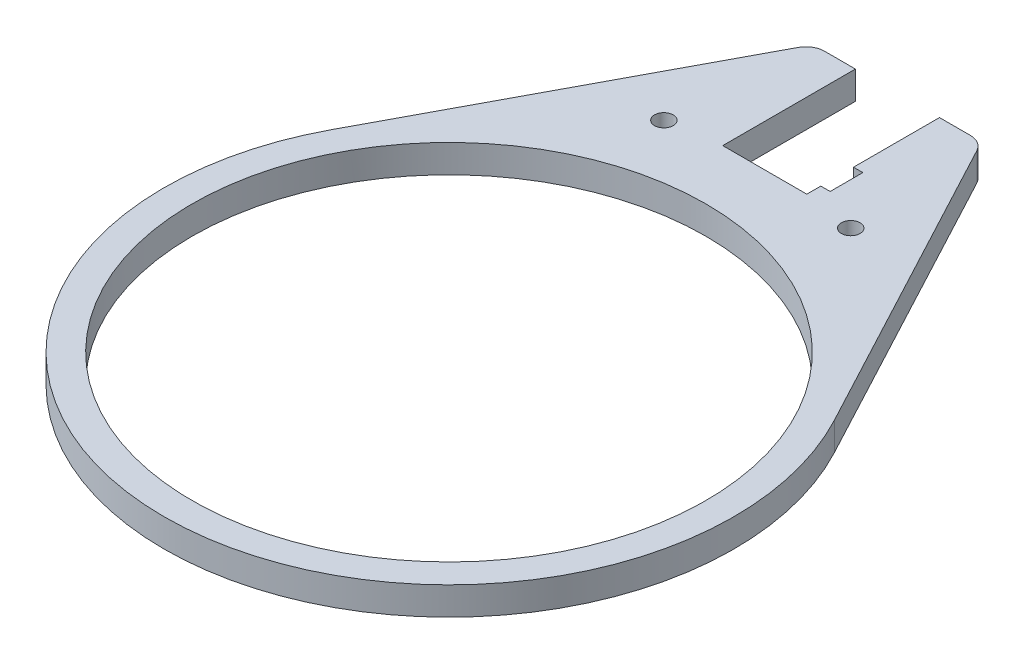
from build123d import *

# Parameters (mm, degrees)
BOSS_EXTRUDE1_DEPTH     = 1
BOSS_EXTRUDE2_DEPTH     = 2
SKETCH5_R               = 2.25
SKETCH5_R_2             = 0.5
CUT_EXTRUDE2_DEPTH      = 75.390311459
CUT_EXTRUDE3_DEPTH      = 75.423910398
CUT_EXTRUDE3_DEPTH_BACK = 75.423910398
SKETCH6_OUTSIDE_W       = 86.15
SKETCH6_OUTSIDE_H       = 123.471
SKETCH6_OUTSIDE_R       = 30.5
BOSS_EXTRUDE3_DEPTH     = 3
SKETCH8_W               = 9
SKETCH8_H               = 28.4
CUT_EXTRUDE4_DEPTH      = 3
SKETCH10_W              = 1.894041394
SKETCH10_H              = 3.5
CUT_EXTRUDE6_DEPTH      = 13
CUT_EXTRUDE7_DEPTH      = 57.949539067
CUT_EXTRUDE7_DEPTH_BACK = 57.949539067
SKETCH11_R              = 27.5
SKETCH11_W              = 9
SKETCH11_H              = 14.2
CUT_EXTRUDE8_DEPTH      = 57.949539067
CUT_EXTRUDE8_DEPTH_BACK = 57.949539067
SKETCH12_R              = 1


with BuildPart() as part:
    # Sketch2 → Boss-Extrude1 (new body)
    with BuildSketch(Plane(origin=(0, 0, 0), x_dir=(1, 0, 0), z_dir=(0, 1, 0))):
        with BuildLine():
            Line((-9.5, 67.820855486), (9.5, 67.820855486))
            ThreePointArc((9.5, 67.820855486), (11.621320344, 66.94217583), (12.5, 64.820855486))
            Line((12.5, 64.820855486), (12.5, 33.674916481))
            ThreePointArc((12.5, 33.674916481), (13.680828963, 28.960871273), (16.944444444, 25.360122288))
            ThreePointArc((16.944444444, 25.360122288), (0, -30.5), (-16.944444444, 25.360122288))
            ThreePointArc((-16.944444444, 25.360122288), (-13.680828963, 28.960871273), (-12.5, 33.674916481))
            Line((-12.5, 33.674916481), (-12.5, 64.820855486))
            ThreePointArc((-12.5, 64.820855486), (-11.621320344, 66.94217583), (-9.5, 67.820855486))
        make_face()
        with BuildLine():
            Line((3.5516796, -15.713533545), (4.759805249, -3.321913887))
            Line((4.759805249, -3.321913887), (6.334764225, -3.329153378))
            ThreePointArc((6.334764225, -3.329153378), (9.649898055, -0.044356931), (6.365101608, 3.270776898))
            Line((6.365101608, 3.270776898), (4.790142632, 3.278016389))
            Line((4.790142632, 3.278016389), (3.695984805, 15.680218773))
            ThreePointArc((3.695984805, 15.680218773), (0.087334891, 18.999799278), (-3.5516796, 15.713533545))
            Line((-3.5516796, 15.713533545), (-4.759805249, 3.321913887))
            Line((-4.759805249, 3.321913887), (-6.334764225, 3.329153378))
            ThreePointArc((-6.334764225, 3.329153378), (-9.649898055, 0.044356931), (-6.365101608, -3.270776898))
            Line((-6.365101608, -3.270776898), (-4.790142632, -3.278016389))
            Line((-4.790142632, -3.278016389), (-3.695984805, -15.680218773))
            ThreePointArc((-3.695984805, -15.680218773), (-0.087334891, -18.999799278), (3.5516796, -15.713533545))
        make_face(mode=Mode.SUBTRACT)
    extrude(amount=BOSS_EXTRUDE1_DEPTH)

    # Sketch3 → Boss-Extrude2 (add)
    with BuildSketch(Plane(origin=(0, 1, 0), x_dir=(1, 0, 0), z_dir=(0, 1, 0))):
        with BuildLine():
            Line((-12.5, 64.820855486), (-12.5, 33.674916481))
            ThreePointArc((-12.5, 33.674916481), (-13.680828963, 28.960871273), (-16.944444444, 25.360122288))
            ThreePointArc((-16.944444444, 25.360122288), (0, -30.5), (16.944444444, 25.360122288))
            ThreePointArc((16.944444444, 25.360122288), (13.680828963, 28.960871273), (12.5, 33.674916481))
            Line((12.5, 33.674916481), (12.5, 64.820855486))
            ThreePointArc((12.5, 64.820855486), (11.621320344, 66.94217583), (9.5, 67.820855486))
            Line((9.5, 67.820855486), (-9.5, 67.820855486))
            ThreePointArc((-9.5, 67.820855486), (-11.621320344, 66.94217583), (-12.5, 64.820855486))
        make_face()
    extrude(amount=BOSS_EXTRUDE2_DEPTH)

    # Sketch5 → Cut-Extrude2 (cut, through all)
    with BuildSketch(Plane.XZ.offset(-1)):
        Circle(SKETCH5_R)
        with Locations((0.022708028, 13.233852211)):
            Circle(SKETCH5_R_2)
        with Locations((-0.022708028, -13.233852211)):
            Circle(SKETCH5_R_2)
        with Locations((-6.853849078, 0.011760551)):
            Circle(SKETCH5_R_2)
        with Locations((6.853849078, -0.011760551)):
            Circle(SKETCH5_R_2)
    extrude(amount=-CUT_EXTRUDE2_DEPTH, mode=Mode.SUBTRACT)

    # Sketch6 outside → Cut-Extrude3 (cut, two sides: drawn at the far end of the back side and taken through both)
    with BuildSketch(Plane(origin=(0, 3, 0), x_dir=(1, 0, 0), z_dir=(0, 1, 0)).offset(-CUT_EXTRUDE3_DEPTH_BACK)):
        with Locations((0, 18.6605)):
            Rectangle(SKETCH6_OUTSIDE_W, SKETCH6_OUTSIDE_H)
        Circle(SKETCH6_OUTSIDE_R, mode=Mode.SUBTRACT)
    extrude(amount=CUT_EXTRUDE3_DEPTH + CUT_EXTRUDE3_DEPTH_BACK, mode=Mode.SUBTRACT)

    # Sketch7 → Boss-Extrude3 (add)
    with BuildSketch(Plane.XZ):
        with BuildLine():
            Line((-7.798950698, -48), (7.798950698, -48))
            ThreePointArc((7.798950698, -48), (8.828603574, -47.714588859), (9.564382048, -46.939814955))
            Line((9.564382048, -46.939814955), (26.92282808, -14.332178068))
            Line((26.92282808, -14.332178068), (0, -22.549328153))
            Line((0, -22.549328153), (-26.92282808, -14.332178068))
            Line((-26.92282808, -14.332178068), (-9.564382048, -46.939814955))
            ThreePointArc((-9.564382048, -46.939814955), (-8.828603574, -47.714588859), (-7.798950698, -48))
        make_face()
    extrude(amount=-BOSS_EXTRUDE3_DEPTH)

    # Sketch8 → Cut-Extrude4 (cut)
    with BuildSketch(Plane.XZ):
        with Locations((0, -48)):
            Rectangle(SKETCH8_W, SKETCH8_H)
    extrude(amount=-CUT_EXTRUDE4_DEPTH, mode=Mode.SUBTRACT)

    # Sketch10 → Cut-Extrude6 (cut)
    with BuildSketch(Plane.XZ.offset(-3)):
        with Locations((4.552979303, -37.05)):
            Rectangle(SKETCH10_W, SKETCH10_H)
    extrude(amount=CUT_EXTRUDE6_DEPTH, mode=Mode.SUBTRACT)

    # Sketch11 → Cut-Extrude7 (cut, two sides: drawn at the far end of the back side and taken through both)
    with BuildSketch(Plane.XZ.offset(-CUT_EXTRUDE7_DEPTH_BACK)):
        Circle(SKETCH11_R)
        with Locations((0, -40.9)):
            Rectangle(SKETCH11_W, SKETCH11_H)
    extrude(amount=CUT_EXTRUDE7_DEPTH + CUT_EXTRUDE7_DEPTH_BACK, mode=Mode.SUBTRACT)

    # Sketch12 → Cut-Extrude8 (cut, two sides: drawn at the far end of the back side and taken through both)
    with BuildSketch(Plane(origin=(0, 3, 0), x_dir=(1, 0, 0), z_dir=(0, 1, 0)).offset(-CUT_EXTRUDE8_DEPTH_BACK)):
        with Locations((-10, 33)):
            Circle(SKETCH12_R)
        with Locations((10, 33)):
            Circle(SKETCH12_R)
    extrude(amount=CUT_EXTRUDE8_DEPTH + CUT_EXTRUDE8_DEPTH_BACK, mode=Mode.SUBTRACT)


solid = part.part
